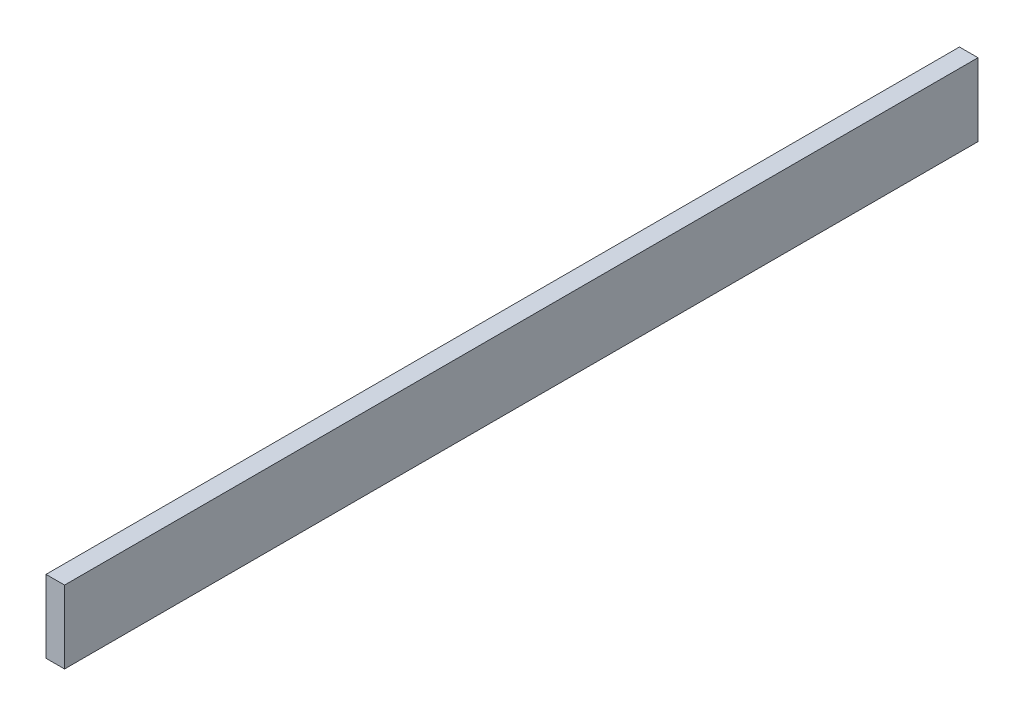
from build123d import *

# Parameters (mm, degrees)
SKETCH1_W           = 20.32
SKETCH1_H           = 79.586666328
BOSS_EXTRUDE1_DEPTH = 1000


with BuildPart() as part:
    # Sketch1 → Boss-Extrude1 (new body)
    with BuildSketch(Plane.XY):
        Rectangle(SKETCH1_W, SKETCH1_H)
    extrude(amount=BOSS_EXTRUDE1_DEPTH)


solid = part.part
